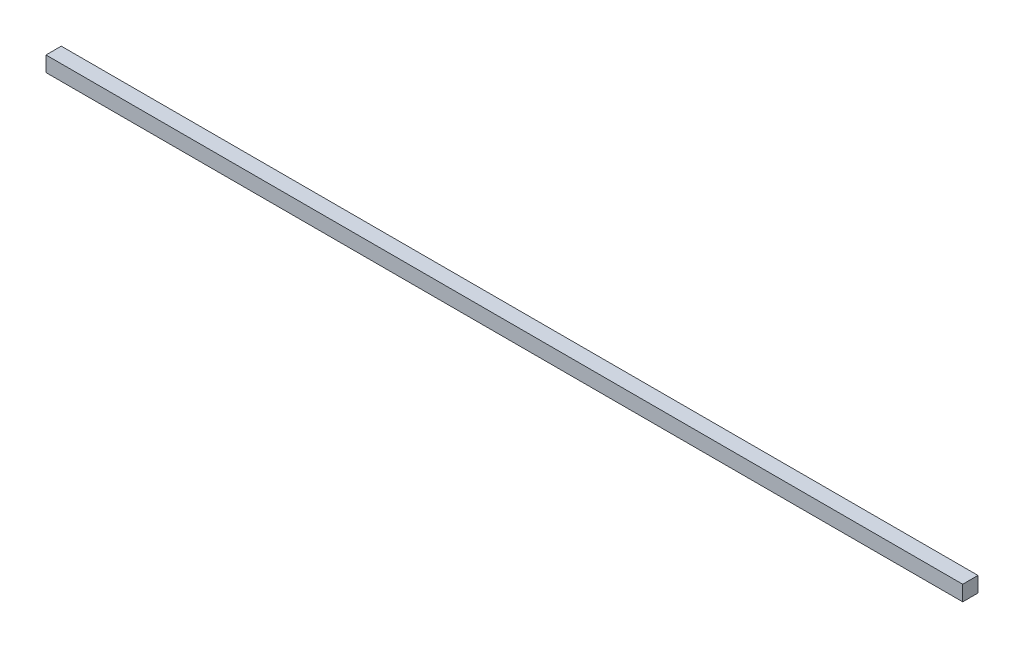
from build123d import *

# Parameters (mm, degrees)
SKETCH_1_W      = 1200
SKETCH_1_H      = 20
EXTRUDE_1_DEPTH = 20


with BuildPart() as part:
    # 草图1 → 凸台-拉伸1 (new body)
    with BuildSketch(Plane(origin=(0, 0, 0), x_dir=(1, 0, 0), z_dir=(0, 1, 0))):
        with Locations((0, 210)):
            Rectangle(SKETCH_1_W, SKETCH_1_H)
    extrude(amount=EXTRUDE_1_DEPTH)


solid = part.part
